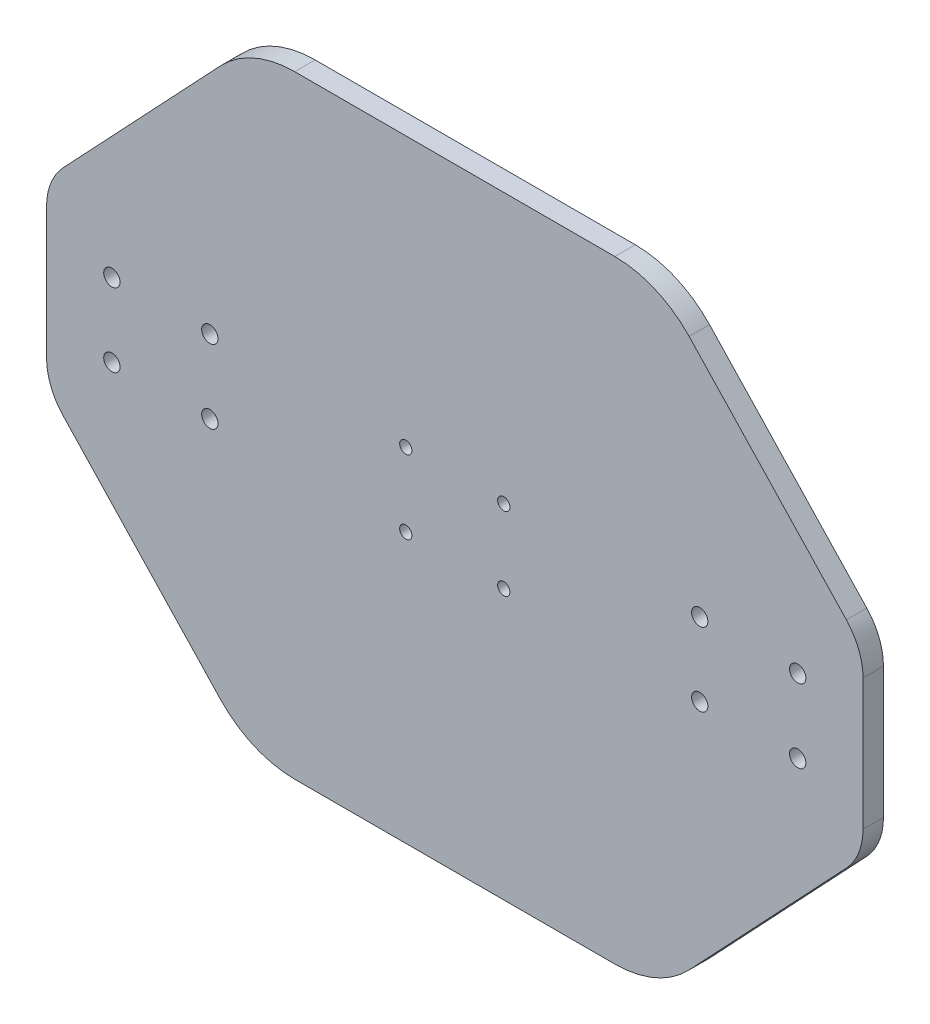
from build123d import *

# Parameters (mm, degrees)
CROQUIS1_W              = 200
CROQUIS1_H              = 150.1
SALIENTE_EXTRUIR1_DEPTH = 5
CROQUIS2_R              = 1.5
CROQUIS2_R_2            = 2
CORTAR_EXTRUIR1_DEPTH   = 10
CORTAR_EXTRUIR2_DEPTH   = 400


with BuildPart() as part:
    # Croquis1 → Saliente-Extruir1 (new body)
    with BuildSketch(Plane.XY):
        with Locations((100, 5.648844896)):
            Rectangle(CROQUIS1_W, CROQUIS1_H)
    extrude(amount=SALIENTE_EXTRUIR1_DEPTH)

    # Croquis2 → Cortar-Extruir1 (cut)
    with BuildSketch(Plane.XY.offset(5)):
        with Locations((88, 14.648844896)):
            Circle(CROQUIS2_R)
        with Locations((112, 14.648844896)):
            Circle(CROQUIS2_R)
        with Locations((88, -3.351155104)):
            Circle(CROQUIS2_R)
        with Locations((112, -3.351155104)):
            Circle(CROQUIS2_R)
        with Locations((16, 14.648844896)):
            Circle(CROQUIS2_R_2)
        with Locations((40, 14.648844896)):
            Circle(CROQUIS2_R_2)
        with Locations((40, -3.351155104)):
            Circle(CROQUIS2_R_2)
        with Locations((16, -3.351155104)):
            Circle(CROQUIS2_R_2)
        with Locations((184, -3.351155104)):
            Circle(CROQUIS2_R_2)
        with Locations((160, -3.351155104)):
            Circle(CROQUIS2_R_2)
        with Locations((160, 14.648844896)):
            Circle(CROQUIS2_R_2)
        with Locations((184, 14.648844896)):
            Circle(CROQUIS2_R_2)
    extrude(amount=-CORTAR_EXTRUIR1_DEPTH, mode=Mode.SUBTRACT)

    # Croquis3 → Cortar-Extruir2 (cut)
    with BuildSketch(Plane(origin=(0, 0, 0), x_dir=(-1, 0, 0), z_dir=(0, 0, -1))):
        with BuildLine():
            Line((-195.915748263, 31.98223599), (-157.401555296, 72.845794728))
            ThreePointArc((-157.401555296, 72.845794728), (-149.116372199, 78.651772224), (-139.208641525, 80.698844896))
            Line((-139.208641525, 80.698844896), (-200, 80.698844896))
            Line((-200, 80.698844896), (-200, 21.694066091))
            ThreePointArc((-200, 21.694066091), (-198.941596464, 27.2286743), (-195.915748263, 31.98223599))
        make_face()
        with BuildLine():
            Line((0, 80.698844896), (-60.791358475, 80.698844896))
            ThreePointArc((-60.791358475, 80.698844896), (-50.883627801, 78.651772224), (-42.598444704, 72.845794728))
            Line((-42.598444704, 72.845794728), (-4.084251737, 31.98223599))
            ThreePointArc((-4.084251737, 31.98223599), (-1.058403536, 27.2286743), (0, 21.694066091))
            Line((0, 21.694066091), (0, 80.698844896))
        make_face()
        with BuildLine():
            Line((0, -69.401155104), (0, -10.396376298))
            ThreePointArc((0, -10.396376298), (-1.058403536, -15.930984508), (-4.084251737, -20.684546197))
            Line((-4.084251737, -20.684546197), (-42.598444704, -61.548104935))
            ThreePointArc((-42.598444704, -61.548104935), (-50.883627801, -67.354082431), (-60.791358475, -69.401155104))
            Line((-60.791358475, -69.401155104), (0, -69.401155104))
        make_face()
        with BuildLine():
            ThreePointArc((-195.915748263, -20.684546197), (-198.941596464, -15.930984508), (-200, -10.396376298))
            Line((-200, -10.396376298), (-200, -69.401155104))
            Line((-200, -69.401155104), (-139.208641525, -69.401155104))
            ThreePointArc((-139.208641525, -69.401155104), (-149.116372199, -67.354082431), (-157.401555296, -61.548104935))
            Line((-157.401555296, -61.548104935), (-195.915748263, -20.684546197))
        make_face()
    extrude(amount=-CORTAR_EXTRUIR2_DEPTH, mode=Mode.SUBTRACT)


solid = part.part
